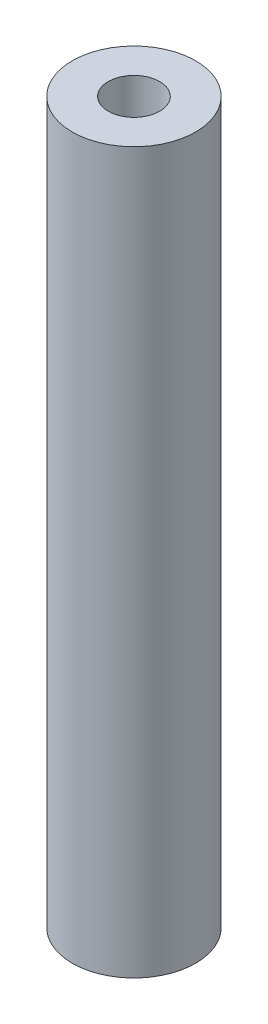
from build123d import *

# Parameters (mm, degrees)
SKETCH1_R                   = 3
BOSS_EXTRUDE1_DEPTH         = 35
TAP_DRILL_FOR_M3X0_5_TAP1_D = 2.5


with BuildPart() as part:
    # Sketch1 → Boss-Extrude1 (new body)
    with BuildSketch(Plane(origin=(0, 0, 0), x_dir=(1, 0, 0), z_dir=(0, 1, 0))):
        with Locations(Location((0, 0, 0), (0, 0, 270))):
            Circle(SKETCH1_R)
    extrude(amount=BOSS_EXTRUDE1_DEPTH)

    # Tap Drill for M3x0.5 Tap1 (through all)
    with Locations(Plane(origin=(0, 35, 0), x_dir=(1, 0, 0), z_dir=(0, 1, 0))):
        with Locations((0, 0)):
            Hole(TAP_DRILL_FOR_M3X0_5_TAP1_D / 2)


solid = part.part
